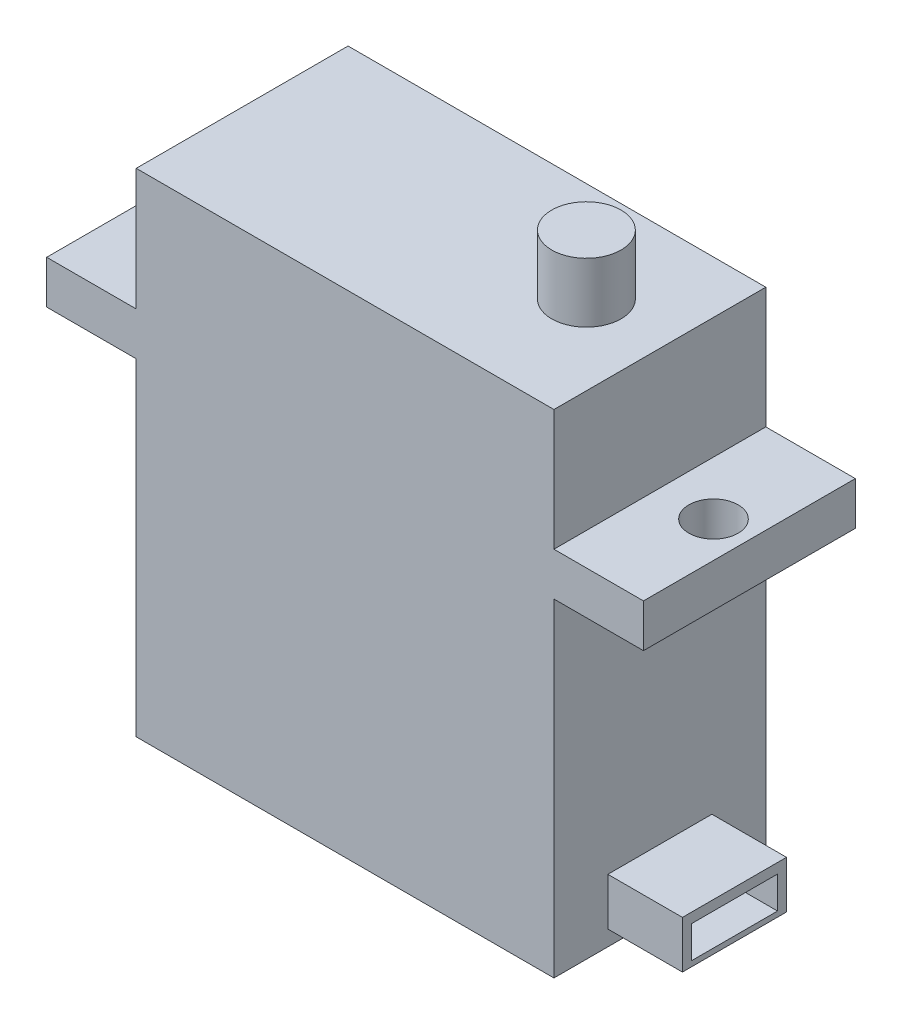
from build123d import *

# Parameters (mm, degrees)
SKETCH1_W           = 28
SKETCH1_H           = 14.2
BOSS_EXTRUDE1_DEPTH = 33
SKETCH2_R           = 2.321908149
BOSS_EXTRUDE3_DEPTH = 4
SKETCH3_W           = 6.974752534
SKETCH3_H           = 3.176308394
BOSS_EXTRUDE4_DEPTH = 5
SKETCH4_W           = 5.77752576
SKETCH4_H           = 2.149777027
CUT_EXTRUDE1_DEPTH  = 5
SKETCH6_W           = 14.2
SKETCH6_H           = 2.892759627
BOSS_EXTRUDE5_DEPTH = 6
SKETCH11_W          = 14.2
SKETCH11_H          = 2.89
BOSS_EXTRUDE6_DEPTH = 6
SKETCH12_R          = 1.651
CUT_EXTRUDE4_DEPTH  = 6
SKETCH17_R          = 1.651
CUT_EXTRUDE5_DEPTH  = 45.435355427


with BuildPart() as part:
    # Sketch1 → Boss-Extrude1 (new body)
    with BuildSketch(Plane(origin=(0, 0, 0), x_dir=(1, 0, 0), z_dir=(0, 1, 0))):
        with Locations((-14, 7.1)):
            Rectangle(SKETCH1_W, SKETCH1_H)
    extrude(amount=BOSS_EXTRUDE1_DEPTH)

    # Sketch2 → Boss-Extrude3 (add)
    with BuildSketch(Plane(origin=(0, 33, 0), x_dir=(1, 0, 0), z_dir=(0, 1, 0))):
        with Locations(Location((-5.331542912, 7.506333926, 0), (0, 0, 270))):
            Circle(SKETCH2_R)
    extrude(amount=BOSS_EXTRUDE3_DEPTH)

    # Sketch3 → Boss-Extrude4 (add)
    with BuildSketch(Plane(origin=(0, 0, 0), x_dir=(0, 0, -1), z_dir=(1, 0, 0))):
        with Locations((7.1, 2.624490745)):
            Rectangle(SKETCH3_W, SKETCH3_H)
    extrude(amount=BOSS_EXTRUDE4_DEPTH)

    # Sketch4 → Cut-Extrude1 (cut)
    with BuildSketch(Plane(origin=(5, 0, 0), x_dir=(0, 0, -1), z_dir=(1, 0, 0))):
        with Locations((7.1, 2.467865933)):
            Rectangle(SKETCH4_W, SKETCH4_H)
    extrude(amount=-CUT_EXTRUDE1_DEPTH, mode=Mode.SUBTRACT)

    # Sketch6 → Boss-Extrude5 (add)
    with BuildSketch(Plane.ZY.offset(28)):
        with Locations((-7.1, 23.390302975)):
            Rectangle(SKETCH6_W, SKETCH6_H)
    extrude(amount=BOSS_EXTRUDE5_DEPTH)

    # Sketch11 → Boss-Extrude6 (add)
    with BuildSketch(Plane(origin=(0, 0, 0), x_dir=(0, 0, -1), z_dir=(1, 0, 0))):
        with Locations((7.1, 23.445)):
            Rectangle(SKETCH11_W, SKETCH11_H)
    extrude(amount=BOSS_EXTRUDE6_DEPTH)

    # Sketch12 → Cut-Extrude4 (cut)
    with BuildSketch(Plane(origin=(0, 24.89, 0), x_dir=(1, 0, 0), z_dir=(0, 1, 0))):
        with Locations(Location((3.594494482, 7.1, 0), (0, 0, 270))):
            Circle(SKETCH12_R)
    extrude(amount=-CUT_EXTRUDE4_DEPTH, mode=Mode.SUBTRACT)

    # Sketch17 → Cut-Extrude5 (cut, through all)
    with BuildSketch(Plane(origin=(0, 24.836682788, 0), x_dir=(1, 0, 0), z_dir=(0, 1, 0))):
        with Locations(Location((-31.335208853, 7.1, 0), (0, 0, 270))):
            Circle(SKETCH17_R)
    extrude(amount=-CUT_EXTRUDE5_DEPTH, mode=Mode.SUBTRACT)


solid = part.part
